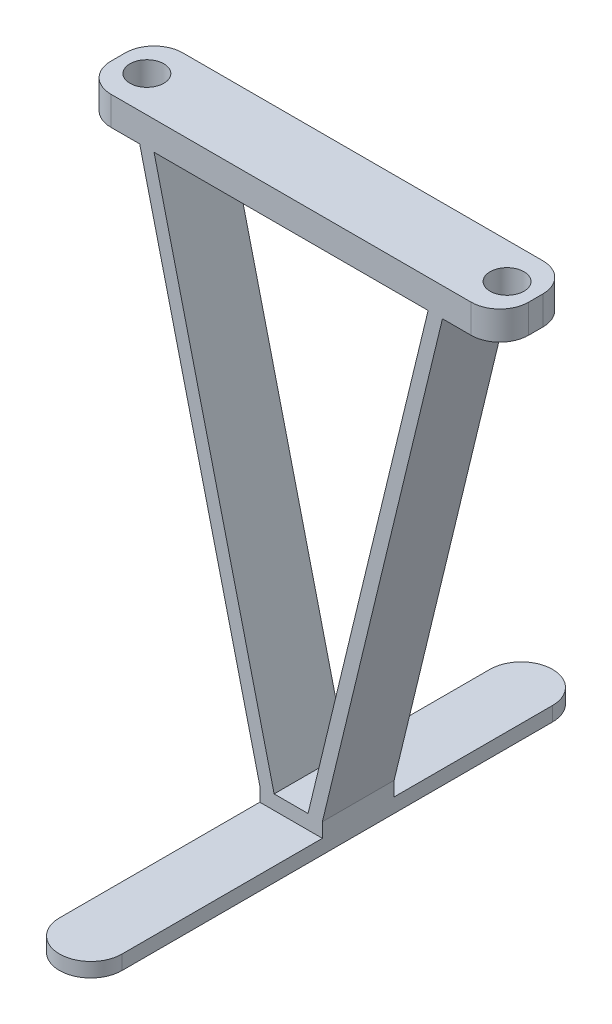
from build123d import *

# Parameters (mm, degrees)
SKETCH1_R           = 3
BOSS_EXTRUDE1_DEPTH = 5.08
BOSS_EXTRUDE2_DEPTH = 12.7
BOSS_EXTRUDE3_DEPTH = 2.54


with BuildPart() as part:
    # Sketch1 → Boss-Extrude1 (new body)
    with BuildSketch(Plane(origin=(0, 0, 0), x_dir=(1, 0, 0), z_dir=(0, 1, 0))):
        with BuildLine():
            Line((-24.747623202, 6.35), (-30.399794039, 6.35))
            ThreePointArc((-30.399794039, 6.35), (-33.991896487, 4.862102448), (-35.479794039, 1.27))
            Line((-35.479794039, 1.27), (-35.479794039, -1.27))
            ThreePointArc((-35.479794039, -1.27), (-33.991896487, -4.862102448), (-30.399794039, -6.35))
            Line((-30.399794039, -6.35), (-24.747623202, -6.35))
            Line((-24.747623202, -6.35), (27.702035125, -6.35))
            Line((27.702035125, -6.35), (33.354205961, -6.35))
            ThreePointArc((33.354205961, -6.35), (36.94630841, -4.862102448), (38.434205961, -1.27))
            Line((38.434205961, -1.27), (38.434205961, 1.27))
            ThreePointArc((38.434205961, 1.27), (36.94630841, 4.862102448), (33.354205961, 6.35))
            Line((33.354205961, 6.35), (27.702035125, 6.35))
            Line((27.702035125, 6.35), (-24.747623202, 6.35))
        make_face()
        with Locations(Location((-30.399794039, 0, 0), (0, 0, 270))):
            Circle(SKETCH1_R, mode=Mode.SUBTRACT)
        with Locations(Location((33.354205961, 0, 0), (0, 0, 270))):
            Circle(SKETCH1_R, mode=Mode.SUBTRACT)
    extrude(amount=BOSS_EXTRUDE1_DEPTH)

    # Sketch3 → Boss-Extrude2 (add)
    with BuildSketch(Plane.XY.offset(6.35)):
        Polygon((-25.319794039, 0), (-4.062794039, -87.74317324), (-4.062794039, -90.28317324), (7.017205961, -90.28317324), (7.017205961, -87.74317324), (28.274205961, 0), (25.734205961, 0), (4.477205961, -87.74317324), (-1.522794039, -87.74317324), (-22.779794039, 0), align=None)
    extrude(amount=-BOSS_EXTRUDE2_DEPTH)

    # Sketch4 → Boss-Extrude3 (add)
    with BuildSketch(Plane.XZ.offset(90.28317324)):
        with BuildLine():
            Line((-4.062794039, 41.80872522), (-4.062794039, -34.39127478))
            ThreePointArc((-4.062794039, -34.39127478), (1.477205961, -39.93127478), (7.017205961, -34.39127478))
            Line((7.017205961, -34.39127478), (7.017205961, 41.80872522))
            ThreePointArc((7.017205961, 41.80872522), (1.477205961, 47.34872522), (-4.062794039, 41.80872522))
        make_face()
    extrude(amount=BOSS_EXTRUDE3_DEPTH)


solid = part.part
